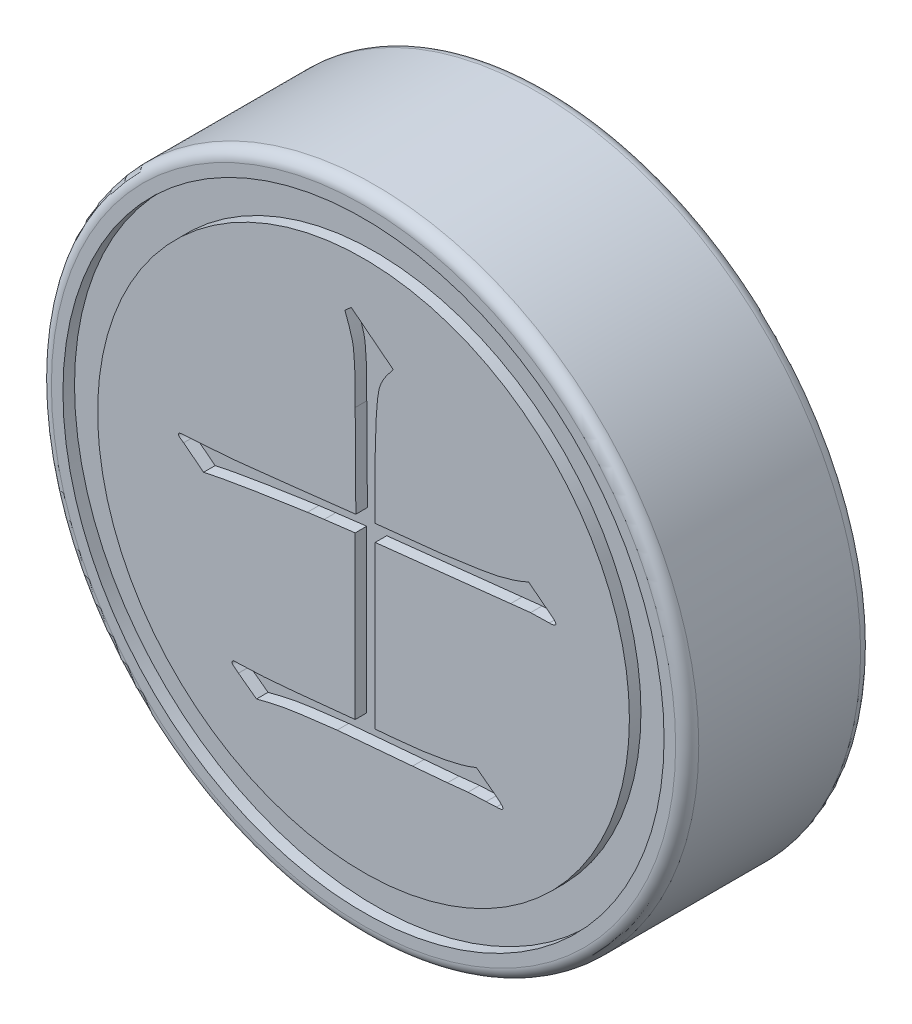
from build123d import *

# Parameters (mm, degrees)
SKETCH_1_R          = 14
EXTRUDE_1_DEPTH     = 8
SKETCH_2_R          = 13
SKETCH_2_R_2        = 11.5
CUT_EXTRUDE_1_DEPTH = 0.5
SKETCH_3_R          = 5.1
CUT_EXTRUDE_2_DEPTH = 5
CHAMFER_1_SIZE      = 0.5
FILLET_1_R          = 0.5
CUT_EXTRUDE_3_DEPTH = 0.5


with BuildPart() as part:
    # 草图1 → 凸台-拉伸1 (new body)
    with BuildSketch(Plane.XY):
        Circle(SKETCH_1_R)
    extrude(amount=EXTRUDE_1_DEPTH)

    # 草图2 → 切除-拉伸1 (cut)
    with BuildSketch(Plane.XY.offset(8)):
        Circle(SKETCH_2_R)
        Circle(SKETCH_2_R_2, mode=Mode.SUBTRACT)
    extrude(amount=-CUT_EXTRUDE_1_DEPTH, mode=Mode.SUBTRACT)

    # 草图3 → 切除-拉伸2 (cut)
    with BuildSketch(Plane(origin=(0, 0, 0), x_dir=(-1, 0, 0), z_dir=(0, 0, -1))):
        Circle(SKETCH_3_R)
    extrude(amount=-CUT_EXTRUDE_2_DEPTH, mode=Mode.SUBTRACT)

    # 倒角1
    chamfer_1_edges = [part.edges().sort_by_distance(p)[0] for p in [
        (5.1, 0, 0),
    ]]
    chamfer(chamfer_1_edges, length=CHAMFER_1_SIZE)

    # 圆角1
    fillet_1_edges = [part.edges().sort_by_distance(p)[0] for p in [
        (-14, 0, 0),
        (-14, 0, 8),
    ]]
    fillet(fillet_1_edges, radius=FILLET_1_R)

    # 草图4 → 切除-拉伸3 (cut)
    with BuildSketch(Plane.XY.offset(8)):
        with BuildLine():
            Line((-0.332439592, 1.750042466), (-0.360140423, 5.733421968))
            add(Edge.make_bspline(
                [(-0.360140423, 5.733421968), (-0.361352645, 5.905161235), (-0.363614161, 6.225557253), (-0.362563714, 6.6716641), (-0.376473853, 7.047374008), (-0.385330649, 7.359666935), (-0.402429288, 7.62108814), (-0.424047197, 7.845666351), (-0.450655997, 8.039057288), (-0.486147264, 8.214138322), (-0.538863863, 8.394313463), (-0.604319105, 8.608623265), (-0.69811297, 8.866152605), (-0.768099985, 9.052974569), (-0.806123802, 9.154474599)],
                knots=[0, 0, 0, 0, 1.776080644, 3.313448207, 4.612630616, 5.663679929, 6.544024972, 7.321231433, 7.996425259, 8.561978184, 9.16664432, 9.936779763, 10.879056232, 12, 12, 12, 12], degree=3))
            Line((-0.806123802, 9.154474599), (-0.529115492, 9.398241912))
            Line((-0.529115492, 9.398241912), (1.28528894, 7.977189281))
            add(Edge.make_bspline(
                [(1.28528894, 7.977189281), (1.212689416, 7.888764213), (1.076355109, 7.72271119), (0.907905181, 7.473619686), (0.778857884, 7.248302871), (0.690090199, 7.028698577), (0.643415827, 6.786186198), (0.597023873, 6.498405776), (0.567426595, 6.145605356), (0.545007238, 5.747427005), (0.525356606, 5.343894899), (0.516092277, 4.972576481), (0.505970295, 4.653140232), (0.504704552, 4.457343357), (0.504125505, 4.367770998)],
                knots=[0, 0, 0, 0, 1.084774512, 2.037092997, 2.848708899, 3.544871268, 4.271658147, 5.184656451, 6.310726112, 7.626940673, 8.968471314, 10.142701689, 11.150330718, 12, 12, 12, 12], degree=3))
            Line((0.504125505, 4.367770998), (0.504125505, 1.82483471))
            Line((0.504125505, 1.82483471), (3.321300021, 2.124003685))
            add(Edge.make_bspline(
                [(3.321300021, 2.124003685), (3.42652928, 2.139025527), (3.663624238, 2.172871655), (4.057608853, 2.222727844), (4.527947814, 2.292502711), (5.058622387, 2.362973897), (5.614072784, 2.456659085), (6.154444434, 2.587180098), (6.664734902, 2.745631608), (6.986142322, 2.880481389), (7.144014702, 2.946718367)],
                knots=[0, 0, 0, 0, 0.649902526, 1.464313377, 2.427986904, 3.556930783, 4.73754275, 5.869953849, 6.953740843, 8, 8, 8, 8], degree=3))
            Line((7.144014702, 2.946718367), (8.035981461, 2.254197591))
            add(Edge.make_bspline(
                [(8.035981461, 2.254197591), (8.080959366, 2.220886663), (8.159539314, 2.162689843), (8.252827302, 2.077830082), (8.307983989, 2.009717031), (8.321391828, 1.94420007), (8.283079852, 1.900605024), (8.222569166, 1.879078168), (8.138400359, 1.862528273), (8.073037414, 1.861454526), (8.035981461, 1.86084579)],
                knots=[0, 0, 0, 0, 1.835156804, 3.206163717, 4.12161621, 4.700123913, 5.196760664, 5.860863374, 6.787267836, 8, 8, 8, 8], degree=3))
            Line((8.035981461, 1.86084579), (7.227117195, 1.844225292))
            Line((7.227117195, 1.844225292), (6.362851267, 1.750042466))
            Line((6.362851267, 1.750042466), (0.504125505, 1.112923353))
            Line((0.504125505, 1.112923353), (0.504125505, -5.878766398))
            Line((0.504125505, -5.878766398), (1.368391433, -5.803974154))
            add(Edge.make_bspline(
                [(1.368391433, -5.803974154), (1.561462147, -5.786385303), (1.935094465, -5.752347189), (2.474534057, -5.688787282), (2.974290009, -5.617039302), (3.434533274, -5.537557716), (3.854668132, -5.448672356), (4.23555044, -5.356628694), (4.575244967, -5.252223674), (4.784345257, -5.169921401), (4.88362689, -5.13084396)],
                knots=[0, 0, 0, 0, 1.29553906, 2.507139754, 3.629368228, 4.669195067, 5.627680362, 6.498691998, 7.287173099, 8, 8, 8, 8], degree=3))
            Line((4.88362689, -5.13084396), (5.775593649, -5.803974154))
            add(Edge.make_bspline(
                [(5.775593649, -5.803974154), (5.817072398, -5.83713927), (5.888656192, -5.894375444), (5.971238583, -5.979775819), (6.02161762, -6.04253168), (6.035824152, -6.104047047), (5.996806703, -6.143717178), (5.936119537, -6.162435734), (5.850855599, -6.175102485), (5.784876091, -6.176917826), (5.747892818, -6.177935373)],
                knots=[0, 0, 0, 0, 1.812194932, 3.127475989, 4.036720824, 4.576297278, 5.068692798, 5.747705924, 6.737529143, 8, 8, 8, 8], degree=3))
            Line((5.747892818, -6.177935373), (5.301909439, -6.197325955))
            Line((5.301909439, -6.197325955), (4.520746004, -6.233337035))
            Line((4.520746004, -6.233337035), (3.628779245, -6.327519861))
            Line((3.628779245, -6.327519861), (2.121854037, -6.457713766))
            Line((2.121854037, -6.457713766), (-1.141303857, -6.740262243))
            add(Edge.make_bspline(
                [(-1.141303857, -6.740262243), (-1.255758527, -6.754469707), (-1.47626363, -6.781841404), (-1.794394083, -6.815523946), (-2.0867365, -6.853615725), (-2.354021003, -6.884446926), (-2.596232118, -6.920650211), (-2.813843434, -6.945556544), (-3.005595903, -6.974642338), (-3.23226146, -7.007828608), (-3.510911328, -7.055457968), (-3.858422546, -7.129968972), (-4.235310728, -7.213583069), (-4.494280475, -7.283092979), (-4.628838483, -7.319209611)],
                knots=[0, 0, 0, 0, 1.173024538, 2.259915622, 3.253542956, 4.171454364, 4.996242764, 5.744084598, 6.39886201, 6.968650651, 8.074127918, 9.273179876, 10.583172403, 12, 12, 12, 12], degree=3))
            Line((-4.628838483, -7.319209611), (-5.410001918, -6.740262243))
            add(Edge.make_bspline(
                [(-5.410001918, -6.740262243), (-5.450722452, -6.709069955), (-5.521636813, -6.654748927), (-5.61115149, -6.583007343), (-5.666823555, -6.533702581), (-5.697711988, -6.484415815), (-5.674943077, -6.430258701), (-5.649144053, -6.4001522), (-5.63437865, -6.382921523)],
                knots=[0, 0, 0, 0, 1.845274552, 3.213525351, 4.10520704, 4.550429949, 5.170376093, 6, 6, 6, 6], degree=3))
            Line((-5.63437865, -6.382921523), (-4.293658428, -6.327519861))
            Line((-4.293658428, -6.327519861), (-2.983409121, -6.216716536))
            Line((-2.983409121, -6.216716536), (-0.360140423, -5.953558642))
            Line((-0.360140423, -5.953558642), (-0.360140423, 1.038131109))
            Line((-0.360140423, 1.038131109), (-1.700860644, 0.871926123))
            Line((-1.700860644, 0.871926123), (-2.426622417, 0.777743297))
            add(Edge.make_bspline(
                [(-2.426622417, 0.777743297), (-2.701812878, 0.737311731), (-3.227393674, 0.660092285), (-3.978116975, 0.546657661), (-4.653090311, 0.441375307), (-5.252805162, 0.34603544), (-5.775671732, 0.252487806), (-6.224429528, 0.175191604), (-6.596059424, 0.099410354), (-6.818167512, 0.051239755), (-6.916927126, 0.02982086)],
                knots=[0, 0, 0, 0, 1.466159973, 2.800189808, 4.002110139, 5.067144397, 6.000968071, 6.801993663, 7.467310513, 8, 8, 8, 8], degree=3))
            Line((-6.916927126, 0.02982086), (-7.781193054, 0.702951054))
            add(Edge.make_bspline(
                [(-7.781193054, 0.702951054), (-7.813806148, 0.724644837), (-7.87162741, 0.763106747), (-7.941670689, 0.817660634), (-7.986665168, 0.854457065), (-8.012472353, 0.892884107), (-7.995931201, 0.936594338), (-7.984222445, 0.966501178), (-7.977868954, 0.982729447)],
                knots=[0, 0, 0, 0, 1.797637159, 3.187114011, 4.056246988, 4.492359064, 5.181912803, 6, 6, 6, 6], degree=3))
            Line((-7.977868954, 0.982729447), (-6.664849564, 1.076912272))
            Line((-6.664849564, 1.076912272), (-5.46540358, 1.171095098))
            Line((-5.46540358, 1.171095098), (-3.094212445, 1.431482909))
            Line((-3.094212445, 1.431482909), (-0.332439592, 1.750042466))
        make_face()
    extrude(amount=-CUT_EXTRUDE_3_DEPTH, mode=Mode.SUBTRACT)


solid = part.part
